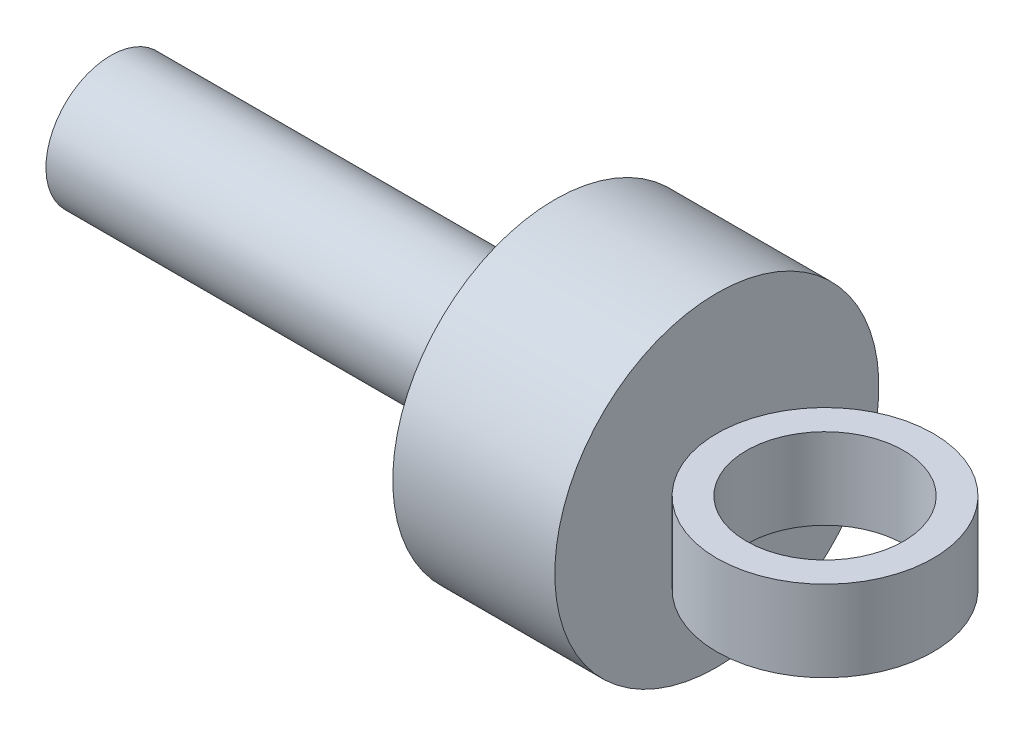
from build123d import *

# Parameters (mm, degrees)
SKETCH2_R           = 20.03
SKETCH2_R_2         = 14.555
BOSS_EXTRUDE1_DEPTH = 7.5


with BuildPart() as part:
    # Sketch1 → Revolve1 (revolve)
    with BuildSketch(Plane.XY):
        Polygon((0, 0), (-112.2, 0), (-112.2, 12), (-1, 12), (-1, 29), (-30, 29), (-30, 30), (0, 30), align=None)
    revolve(axis=Axis((0, 0, 0), (-1, 0, 0)))


with BuildPart() as body_2:
    # Sketch2 → Boss-Extrude1 (new, symmetric)
    with BuildSketch(Plane(origin=(0, 0, 0), x_dir=(1, 0, 0), z_dir=(0, 1, 0))):
        with Locations(Location((20.03, 0, 0), (0, 0, 270))):
            Circle(SKETCH2_R)
        with Locations(Location((20.03, 0, 0), (0, 0, 270))):
            Circle(SKETCH2_R_2, mode=Mode.SUBTRACT)
    extrude(amount=BOSS_EXTRUDE1_DEPTH, both=True)


solid = Compound([part.part, body_2.part])
